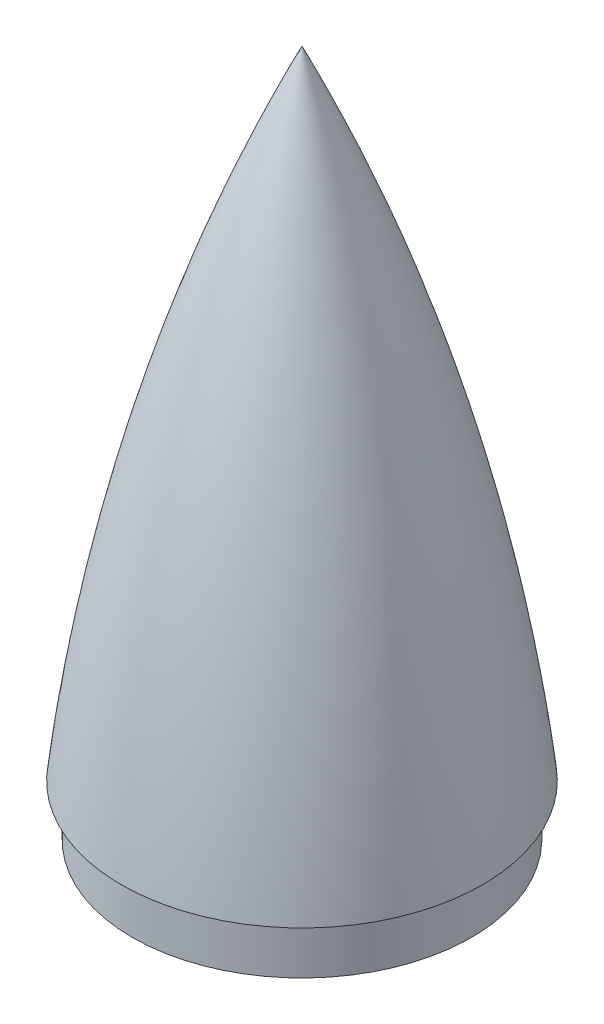
from build123d import *

# Parameters (mm, degrees)
CROQUIS3_R              = 68.895273635
CORTAR_EXTRUIR3_DEPTH   = 204.307108224
SALIENTE_EXTRUIR2_REACH = 203.255
CROQUIS4_R              = 50
CROQUIS4_R_2            = 47
SALIENTE_EXTRUIR3_START = 15
CROQUIS5_R              = 49.8
CROQUIS5_R_2            = 47
SALIENTE_EXTRUIR3_DEPTH = 15


with BuildPart() as part:
    # Croquis1 → Revolución1 (revolve)
    with BuildSketch(Plane(origin=(0, 0, 0), x_dir=(0, 0, -1), z_dir=(1, 0, 0))):
        with BuildLine():
            Line((50, 12), (50, 103.234638666))
            ThreePointArc((50, 103.234638666), (32.109347109, 195.035557404), (0, 282.879020282))
            Line((0, 282.879020282), (0, 290))
            ThreePointArc((0, 290), (42.008882213, 168.091938039), (56.8, 40))
            Line((56.8, 40), (55, 40))
            Line((55, 40), (55, 0))
            Line((55, 0), (50, 0))
            Line((50, 0), (0, 0))
            Line((0, 0), (0, 12))
            Line((0, 12), (50, 12))
        make_face()
    revolve(axis=Axis((0, 0, 0), (0, 1, 0)))

    # Croquis3 → Cortar-Extruir3 (cut, through all)
    with BuildSketch(Plane(origin=(0, 103.234638666, 0), x_dir=(-1, 0, 0), z_dir=(0, -1, 0))):
        Circle(CROQUIS3_R)
    extrude(amount=CORTAR_EXTRUIR3_DEPTH, mode=Mode.SUBTRACT)

    # Croquis4 → Saliente-Extruir2 (add, up to next)
    with BuildSketch(Plane.XZ.offset(-103.234638666), mode=Mode.PRIVATE) as saliente_extruir2_sk1:
        Circle(CROQUIS4_R)
        with Locations(Location((0, 0, 0), (0, 0, 270))):
            Circle(CROQUIS4_R_2, mode=Mode.SUBTRACT)
    saliente_extruir2_tool1 = extrude(saliente_extruir2_sk1.sketch, amount=-SALIENTE_EXTRUIR2_REACH, mode=Mode.PRIVATE) - part.part
    add(saliente_extruir2_tool1.solids().sort_by_distance((-48.585786, 103.234639, 0))[0])

    # Croquis5 → Saliente-Extruir3 (add)
    with BuildSketch(Plane.XZ.offset(-103.234638666).offset(SALIENTE_EXTRUIR3_START)):
        with Locations(Location((0, 0, 0), (0, 0, 270))):
            Circle(CROQUIS5_R)
        with Locations(Location((0, 0, 0), (0, 0, 270))):
            Circle(CROQUIS5_R_2, mode=Mode.SUBTRACT)
    extrude(amount=-SALIENTE_EXTRUIR3_DEPTH)


solid = part.part
